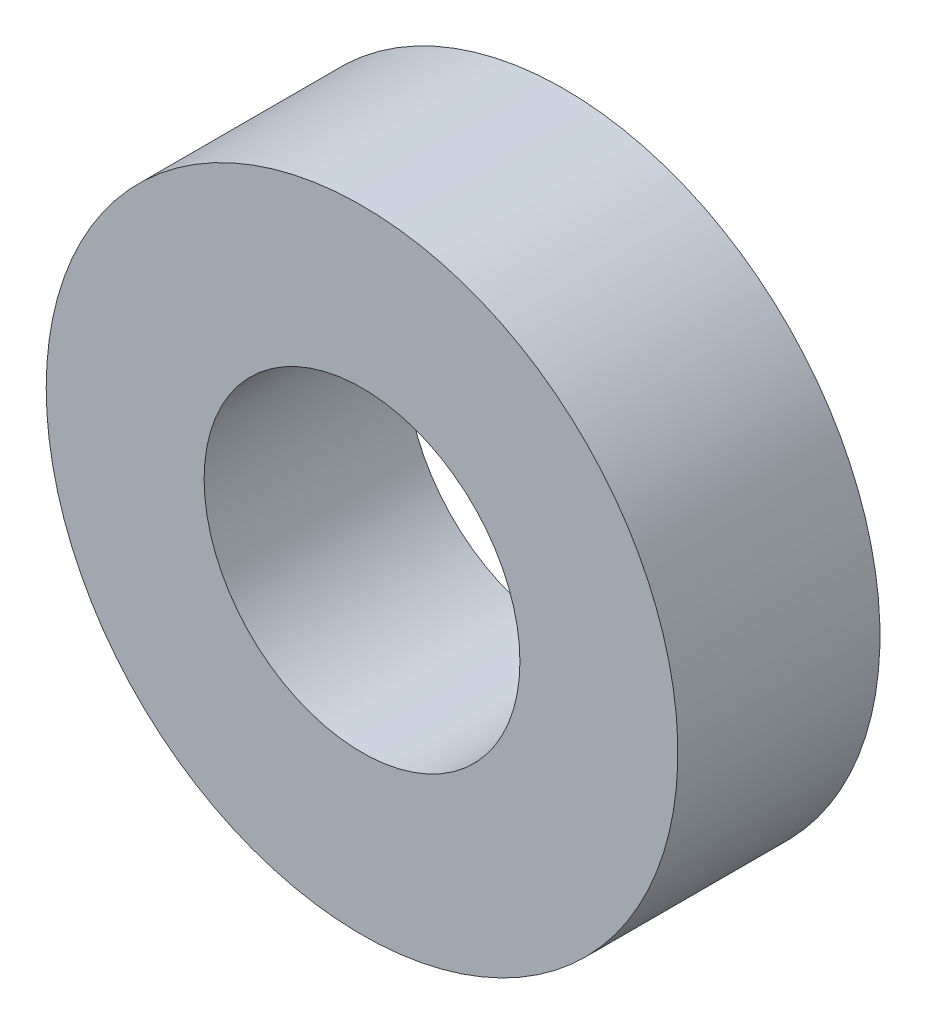
from build123d import *

# Parameters (mm, degrees)
SKETCH1_R      = 25
SKETCH1_R_2    = 12.5
EXTRUDE1_DEPTH = 16


with BuildPart() as part:
    # Sketch1 → Extrude1 (new body)
    with BuildSketch(Plane.XY):
        with Locations(Location((0, 0, 0), (0, 0, 180))):
            Circle(SKETCH1_R)
        with Locations(Location((0, 0, 0), (0, 0, 180))):
            Circle(SKETCH1_R_2, mode=Mode.SUBTRACT)
    extrude(amount=EXTRUDE1_DEPTH)


solid = part.part
